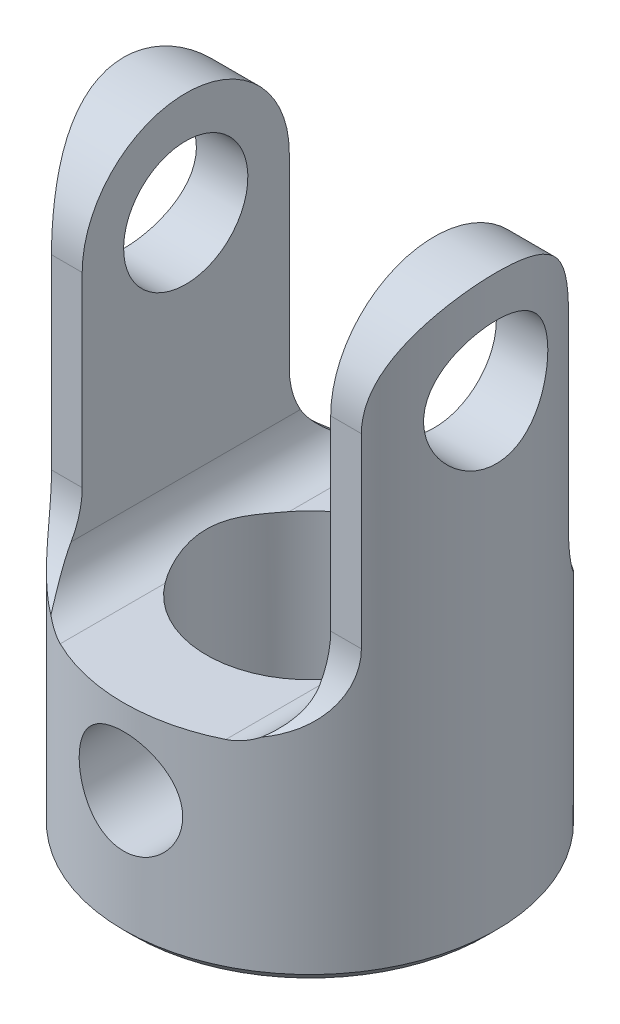
from build123d import *

# Parameters (mm, degrees)
SKETCH1_R               = 4.5
SKETCH1_R_2             = 2.5
BOSS_EXTRUDE1_DEPTH     = 14
CUT_EXTRUDE1_DEPTH      = 16.378556499
CUT_EXTRUDE1_DEPTH_BACK = 16.378556499
SKETCH2_R               = 1.25
CUT_EXTRUDE2_DEPTH      = 16.378556652
CUT_EXTRUDE2_DEPTH_BACK = 16.378556652
SKETCH3_R               = 1.5
CHAMFER1_SIZE           = 0.25


with BuildPart() as part:
    # Sketch1 → Boss-Extrude1 (new body)
    with BuildSketch(Plane(origin=(0, 0, 0), x_dir=(1, 0, 0), z_dir=(0, 1, 0))):
        with Locations(Location((0, 0, 0), (0, 0, 270))):
            Circle(SKETCH1_R)
        with Locations(Location((0, 0, 0), (0, 0, 270))):
            Circle(SKETCH1_R_2, mode=Mode.SUBTRACT)
    extrude(amount=BOSS_EXTRUDE1_DEPTH)

    # Sketch2 → Cut-Extrude1 (cut, two sides: drawn at the far end of the back side and taken through both)
    with BuildSketch(Plane.XY.offset(-CUT_EXTRUDE1_DEPTH_BACK)):
        with Locations((0, 3.15)):
            Circle(SKETCH2_R)
        with BuildLine():
            Line((-3, 14), (3, 14))
            Line((3, 14), (3, 6))
            ThreePointArc((3, 6), (2.707106781, 5.292893219), (2, 5))
            Line((2, 5), (-2, 5))
            ThreePointArc((-2, 5), (-2.707106781, 5.292893219), (-3, 6))
            Line((-3, 6), (-3, 14))
        make_face()
    extrude(amount=CUT_EXTRUDE1_DEPTH + CUT_EXTRUDE1_DEPTH_BACK, mode=Mode.SUBTRACT)

    # Sketch3 → Cut-Extrude2 (cut, two sides: drawn at the far end of the back side and taken through both)
    with BuildSketch(Plane(origin=(0, 0, 0), x_dir=(0, 0, -1), z_dir=(1, 0, 0)).offset(-CUT_EXTRUDE2_DEPTH_BACK)):
        with Locations((0, 11.5)):
            Circle(SKETCH3_R)
        with BuildLine():
            Line((2.5, 11.5), (2.5, 7))
            ThreePointArc((2.5, 7), (3.085786438, 5.585786438), (4.5, 5))
            Line((4.5, 5), (4.5, 15))
            Line((4.5, 15), (-4.5, 15))
            Line((-4.5, 15), (-4.5, 5))
            ThreePointArc((-4.5, 5), (-3.085786438, 5.585786438), (-2.5, 7))
            Line((-2.5, 7), (-2.5, 11.5))
            ThreePointArc((-2.5, 11.5), (0, 14), (2.5, 11.5))
        make_face()
    extrude(amount=CUT_EXTRUDE2_DEPTH + CUT_EXTRUDE2_DEPTH_BACK, mode=Mode.SUBTRACT)

    # Chamfer1
    chamfer1_edges = [part.edges().sort_by_distance(p)[0] for p in [
        (0, 0, -4.5),
    ]]
    chamfer(chamfer1_edges, length=CHAMFER1_SIZE)


solid = part.part
